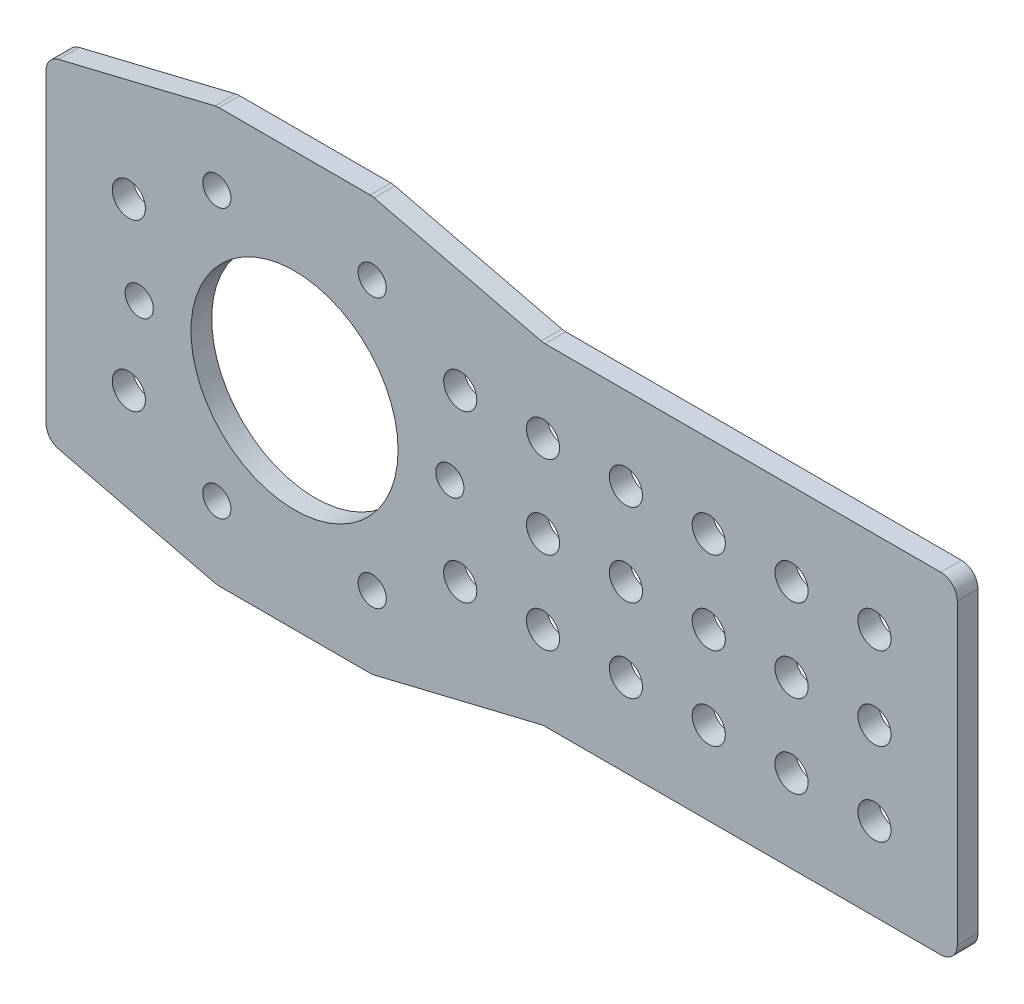
from build123d import *

# Parameters (mm, degrees)
SKETCH2_R           = 15.875
SKETCH2_R_2         = 2.159
SKETCH2_R_3         = 2.54
BOSS_EXTRUDE1_DEPTH = 3.175
FILLET1_R           = 2.54


with BuildPart() as part:
    # Sketch2 → Boss-Extrude1 (new body)
    with BuildSketch(Plane.XY):
        Polygon((-508, 25.4), (-481.80625, 31.75), (-457.99375, 31.75), (-431.8, 25.4), (-368.3, 25.4), (-368.3, -25.4), (-431.8, -25.4), (-457.99375, -31.75), (-481.80625, -31.75), (-508, -25.4), align=None)
        with Locations((-469.9, 0)):
            Circle(SKETCH2_R, mode=Mode.SUBTRACT)
        with Locations((-457.99375, 20.622229928)):
            Circle(SKETCH2_R_2, mode=Mode.SUBTRACT)
        with Locations((-481.80625, 20.622229928)):
            Circle(SKETCH2_R_2, mode=Mode.SUBTRACT)
        with Locations((-493.7125, 0)):
            Circle(SKETCH2_R_2, mode=Mode.SUBTRACT)
        with Locations((-481.80625, -20.622229928)):
            Circle(SKETCH2_R_2, mode=Mode.SUBTRACT)
        with Locations((-457.99375, -20.622229928)):
            Circle(SKETCH2_R_2, mode=Mode.SUBTRACT)
        with Locations((-446.0875, 0)):
            Circle(SKETCH2_R_2, mode=Mode.SUBTRACT)
        with Locations((-495.3, 12.7)):
            Circle(SKETCH2_R_3, mode=Mode.SUBTRACT)
        with Locations((-495.3, -12.7)):
            Circle(SKETCH2_R_3, mode=Mode.SUBTRACT)
        with Locations((-444.5, -12.7)):
            Circle(SKETCH2_R_3, mode=Mode.SUBTRACT)
        with Locations((-431.8, -12.7)):
            Circle(SKETCH2_R_3, mode=Mode.SUBTRACT)
        with Locations((-419.1, -12.7)):
            Circle(SKETCH2_R_3, mode=Mode.SUBTRACT)
        with Locations((-419.1, 0)):
            Circle(SKETCH2_R_3, mode=Mode.SUBTRACT)
        with Locations((-431.8, 0)):
            Circle(SKETCH2_R_3, mode=Mode.SUBTRACT)
        with Locations((-431.8, 12.7)):
            Circle(SKETCH2_R_3, mode=Mode.SUBTRACT)
        with Locations((-419.1, 12.7)):
            Circle(SKETCH2_R_3, mode=Mode.SUBTRACT)
        with Locations((-444.5, 12.7)):
            Circle(SKETCH2_R_3, mode=Mode.SUBTRACT)
        with Locations((-406.4, 12.7)):
            Circle(SKETCH2_R_3, mode=Mode.SUBTRACT)
        with Locations((-406.4, 0)):
            Circle(SKETCH2_R_3, mode=Mode.SUBTRACT)
        with Locations((-406.4, -12.7)):
            Circle(SKETCH2_R_3, mode=Mode.SUBTRACT)
        with Locations((-393.7, 12.7)):
            Circle(SKETCH2_R_3, mode=Mode.SUBTRACT)
        with Locations((-393.7, 0)):
            Circle(SKETCH2_R_3, mode=Mode.SUBTRACT)
        with Locations((-393.7, -12.7)):
            Circle(SKETCH2_R_3, mode=Mode.SUBTRACT)
        with Locations((-381, 12.7)):
            Circle(SKETCH2_R_3, mode=Mode.SUBTRACT)
        with Locations((-381, 0)):
            Circle(SKETCH2_R_3, mode=Mode.SUBTRACT)
        with Locations((-381, -12.7)):
            Circle(SKETCH2_R_3, mode=Mode.SUBTRACT)
    extrude(amount=BOSS_EXTRUDE1_DEPTH)

    # Fillet1
    fillet1_edges = [part.edges().sort_by_distance(p)[0] for p in [
        (-508, 25.4, 1.5875),
        (-481.80625, 31.75, 1.5875),
        (-457.99375, 31.75, 1.5875),
        (-431.8, 25.4, 1.5875),
        (-368.3, 25.4, 1.5875),
        (-368.3, -25.4, 1.5875),
        (-431.8, -25.4, 1.5875),
        (-457.99375, -31.75, 1.5875),
        (-481.80625, -31.75, 1.5875),
        (-508, -25.4, 1.5875),
    ]]
    fillet(fillet1_edges, radius=FILLET1_R)


solid = part.part
